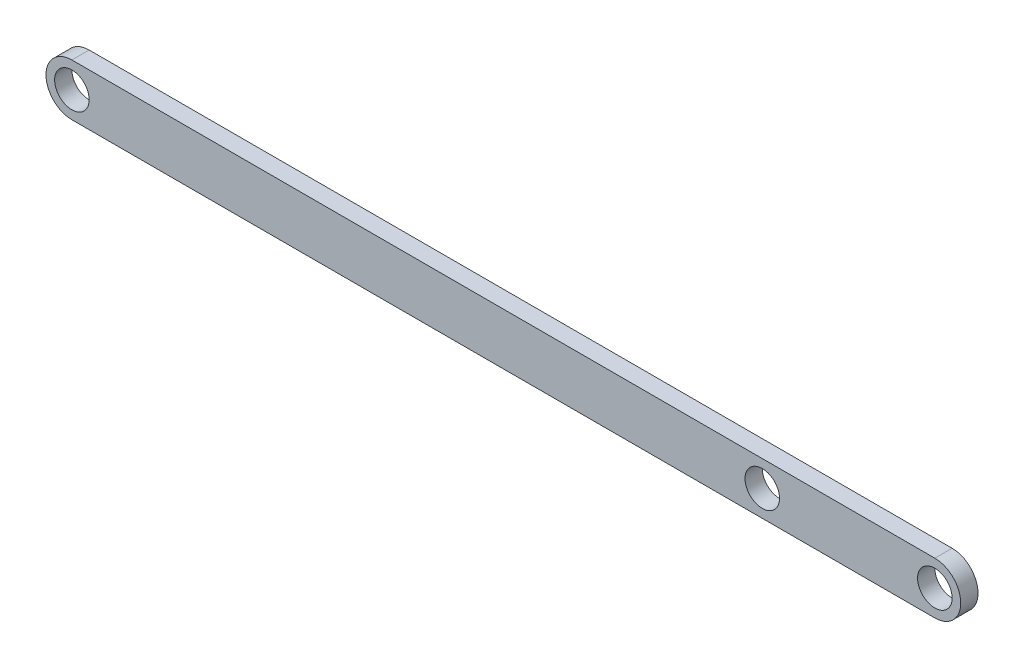
from build123d import *

# Parameters (mm, degrees)
EXTRUDE_2_DEPTH     = 10
SKETCH_2_R          = 10
CUT_EXTRUDE_1_DEPTH = 10
SKETCH_3_R          = 10
CUT_EXTRUDE_2_DEPTH = 10


with BuildPart() as part:
    # Эскиз1 → Бобышка-Вытянуть2 (new body)
    with BuildSketch(Plane.XY):
        with BuildLine():
            Line((0, 0), (-500, 0))
            ThreePointArc((-500, 0), (-515, 15), (-500, 30))
            Line((-500, 30), (0, 30))
            ThreePointArc((0, 30), (15, 15), (0, 0))
        make_face()
    extrude(amount=EXTRUDE_2_DEPTH)

    # Эскиз2 → Вырез-Вытянуть1 (cut)
    with BuildSketch(Plane(origin=(0, 0, 0), x_dir=(-1, 0, 0), z_dir=(0, 0, -1))):
        with Locations((0, 15)):
            Circle(SKETCH_2_R)
        with Locations((500, 15)):
            Circle(SKETCH_2_R)
    extrude(amount=-CUT_EXTRUDE_1_DEPTH, mode=Mode.SUBTRACT)

    # Эскиз3 → Вырез-Вытянуть2 (cut)
    with BuildSketch(Plane.XY.offset(10)):
        with Locations((-100, 15)):
            Circle(SKETCH_3_R)
    extrude(amount=-CUT_EXTRUDE_2_DEPTH, mode=Mode.SUBTRACT)


solid = part.part
